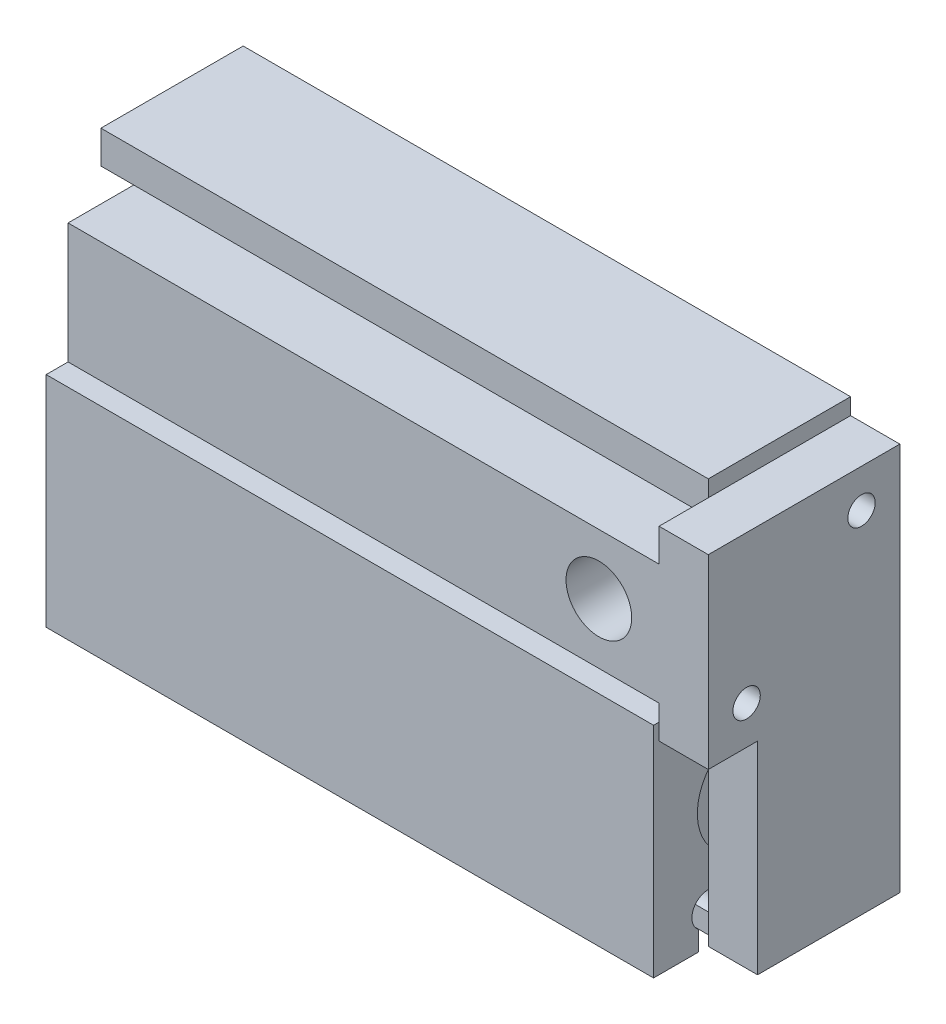
from build123d import *

# Parameters (mm, degrees)
SKETCH_1_W                     = 18
SKETCH_1_H                     = 37
EXTRUDE_1_DEPTH                = 55.5
SKETCH_2_R                     = 5
CUT_EXTRUDE_1_DEPTH            = 0.5
CUT_EXTRUDE_START              = -0.5
SKETCH_3_R                     = 5
CUT_EXTRUDE_2_DEPTH            = 0.5
SKETCH_4_R                     = 1.5
CUT_EXTRUDE_3_DEPTH            = 70.088711089
SKETCH_5_W                     = 1.835428096
SKETCH_5_H                     = 2.75652024
CUT_EXTRUDE_4_DEPTH            = 70.088711089
SKETCH_6_W                     = 5
SKETCH_6_H                     = 17
CUT_EXTRUDE_5_DEPTH            = 70.088711089
SKETCH_7_W                     = 8
SKETCH_7_H                     = 12
CUT_EXTRUDE_6_DEPTH            = 70.088711089
SKETCH_8_R                     = 2.5
EXTRUDE_2_DEPTH                = 1.5
SKETCH_9_W                     = 17.5
SKETCH_9_H                     = 35.5
EXTRUDE_3_DEPTH                = 4.5
SKETCH_10_W                    = 7
SKETCH_10_H                    = 11
EXTRUDE_4_DEPTH                = 54
CUT_EXTRUDE_7_REACH            = 75.58
SKETCH_11_W                    = 4.5
SKETCH_11_H                    = 18.5
HOLE_WIZARD_M3_1_D             = 2.5
HOLE_WIZARD_M3_1_DEPTH         = 7.5
HOLE_WIZARD_M3_1_TIP           = 0.751075774
HOLE_WIZARD_M3_1_2_D           = 3.4
HOLE_WIZARD_M3_1_2_DEPTH       = 5
HOLE_WIZARD_M3_1_2_CBORE_D     = 6.5
HOLE_WIZARD_M3_1_2_CBORE_DEPTH = 3
CUT_EXTRUDE_8_REACH            = 75.704
SKETCH_16_R                    = 3


with BuildPart() as part:
    # 草图1 → 凸台-拉伸1 (new body)
    with BuildSketch(Plane(origin=(0, 0, 0), x_dir=(0, 0, -1), z_dir=(1, 0, 0))):
        with Locations((9, 18.5)):
            Rectangle(SKETCH_1_W, SKETCH_1_H)
    extrude(amount=EXTRUDE_1_DEPTH)

    # 草图2 → 切除-拉伸1 (cut)
    with BuildSketch(Plane.ZY):
        with Locations((-9, 11)):
            Circle(SKETCH_2_R)
    extrude(amount=-CUT_EXTRUDE_1_DEPTH, mode=Mode.SUBTRACT)

    # 草图3 → 切除-拉伸2 (cut)
    with BuildSketch(Plane(origin=(55.5, 0, 0), x_dir=(0, 0, -1), z_dir=(1, 0, 0)).offset(CUT_EXTRUDE_START)):
        with Locations(Location((9, 11, 0), (0, 0, 180))):
            Circle(SKETCH_3_R)
    extrude(amount=CUT_EXTRUDE_2_DEPTH, mode=Mode.SUBTRACT)

    # 草图4 → 切除-拉伸3 (cut, through all)
    with BuildSketch(Plane.ZY):
        with Locations((-13, 3)):
            Circle(SKETCH_4_R)
        with Locations(Location((-5, 3, 0), (0, 0, 180))):
            Circle(SKETCH_4_R)
    extrude(amount=-CUT_EXTRUDE_3_DEPTH, mode=Mode.SUBTRACT)

    # 草图5 → 切除-拉伸4 (cut, through all)
    with BuildSketch(Plane.ZY):
        with Locations((-13, 1.37826012)):
            Rectangle(SKETCH_5_W, SKETCH_5_H)
        with Locations((-5, 1.37826012)):
            Rectangle(SKETCH_5_W, SKETCH_5_H)
    extrude(amount=-CUT_EXTRUDE_4_DEPTH, mode=Mode.SUBTRACT)

    # 草图6 → 切除-拉伸5 (cut, through all)
    with BuildSketch(Plane.ZY):
        with Locations((-2.5, 28.5)):
            Rectangle(SKETCH_6_W, SKETCH_6_H)
    extrude(amount=-CUT_EXTRUDE_5_DEPTH, mode=Mode.SUBTRACT)

    # 草图7 → 切除-拉伸6 (cut, through all)
    with BuildSketch(Plane.ZY):
        with Locations((-9, 28)):
            Rectangle(SKETCH_7_W, SKETCH_7_H)
    extrude(amount=-CUT_EXTRUDE_6_DEPTH, mode=Mode.SUBTRACT)

    # 草图8 → 凸台-拉伸2 (add)
    with BuildSketch(Plane(origin=(55, 0, 0), x_dir=(0, 0, -1), z_dir=(1, 0, 0))):
        with Locations((9, 11)):
            Circle(SKETCH_8_R)
    extrude(amount=EXTRUDE_2_DEPTH)

    # 草图9 → 凸台-拉伸3 (add)
    with BuildSketch(Plane(origin=(56.5, 0, 0), x_dir=(0, 0, -1), z_dir=(1, 0, 0))):
        with Locations((8.25, 18.75)):
            Rectangle(SKETCH_9_W, SKETCH_9_H)
    extrude(amount=EXTRUDE_3_DEPTH)

    # 草图10 → 凸台-拉伸4 (add)
    with BuildSketch(Plane.ZY.offset(-56.5)):
        with Locations((-3, 28)):
            Rectangle(SKETCH_10_W, SKETCH_10_H)
    extrude(amount=EXTRUDE_4_DEPTH)

    # 草图11 → 切除-拉伸7 (cut, up to next)
    with BuildSketch(Plane(origin=(61, 0, 0), x_dir=(0, 0, -1), z_dir=(1, 0, 0)), mode=Mode.PRIVATE) as cut_extrude_7_sk1:
        with Locations((1.75, 10.25)):
            Rectangle(SKETCH_11_W, SKETCH_11_H)
    cut_extrude_7_tool1 = extrude(cut_extrude_7_sk1.sketch, amount=-CUT_EXTRUDE_7_REACH, mode=Mode.PRIVATE) & part.part
    add(cut_extrude_7_tool1.solids().sort_by_distance((61, 10.25, -1.75))[0], mode=Mode.SUBTRACT)

    # Hole Wizard M3 _1
    with Locations(Plane(origin=(61, 0, 0), x_dir=(0, 0, -1), z_dir=(1, 0, 0))):
        with Locations((13.5, 33), (3, 23)):
            Hole(HOLE_WIZARD_M3_1_D / 2, depth=HOLE_WIZARD_M3_1_DEPTH)
            with Locations((0, 0, -(HOLE_WIZARD_M3_1_DEPTH + HOLE_WIZARD_M3_1_TIP / 2))):  # 118° drill point
                Cone(0, HOLE_WIZARD_M3_1_D / 2, HOLE_WIZARD_M3_1_TIP, mode=Mode.SUBTRACT)

    # Hole Wizard M3 _1 2
    with Locations(Plane.XY.offset(-13)):
        with Locations((4, 28), (51.5, 28)):
            CounterBoreHole(HOLE_WIZARD_M3_1_2_D / 2, HOLE_WIZARD_M3_1_2_CBORE_D / 2, HOLE_WIZARD_M3_1_2_CBORE_DEPTH, depth=HOLE_WIZARD_M3_1_2_DEPTH)

    # 草图16 → 切除-拉伸8 (cut, up to next)
    with BuildSketch(Plane.XY.offset(0.5), mode=Mode.PRIVATE) as cut_extrude_8_sk1:
        with Locations((51, 28)):
            Circle(SKETCH_16_R)
    cut_extrude_8_tool1 = extrude(cut_extrude_8_sk1.sketch, amount=-CUT_EXTRUDE_8_REACH, mode=Mode.PRIVATE) & part.part
    add(cut_extrude_8_tool1.solids().sort_by_distance((51, 28, 0.5))[0], mode=Mode.SUBTRACT)


solid = part.part
